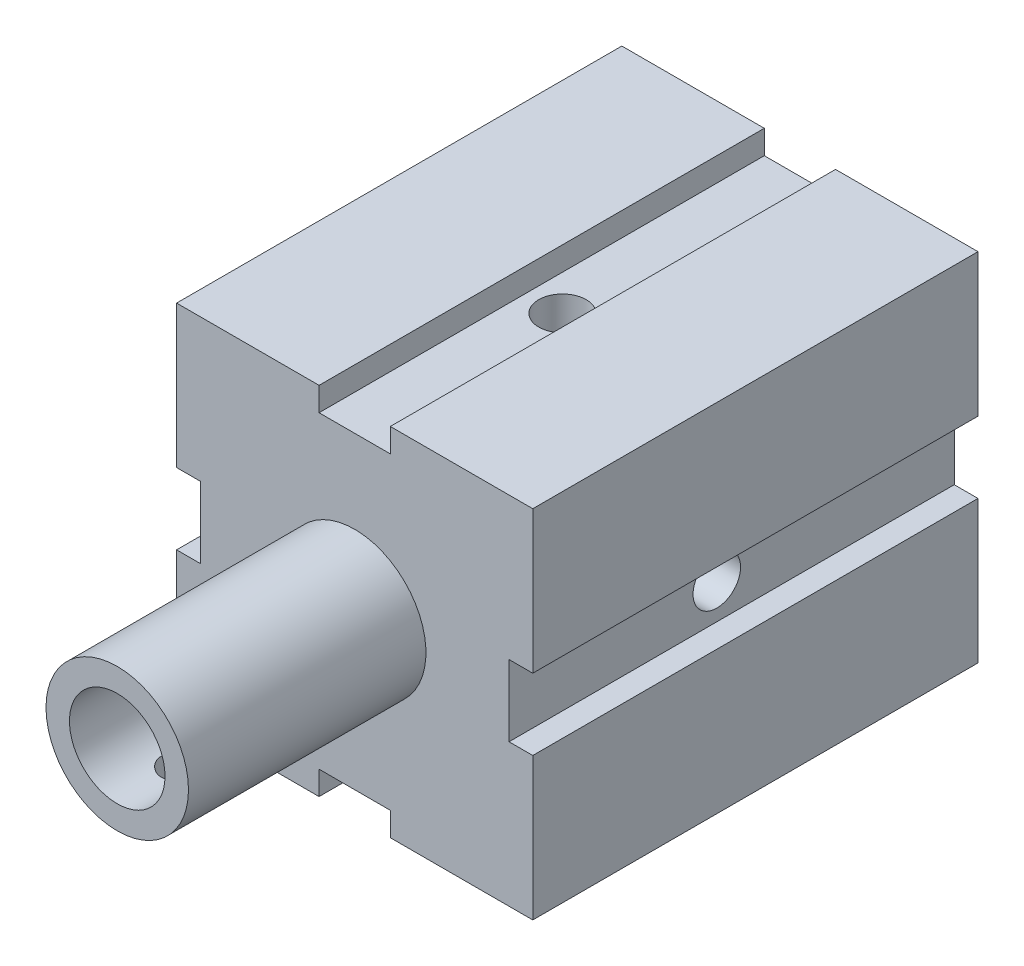
from build123d import *

# Parameters (mm, degrees)
SKETCH1_W                           = 30
SKETCH1_H                           = 30
BOSS_EXTRUDE1_DEPTH                 = 37.5
SKETCH2_R                           = 6
SKETCH2_R_2                         = 4.025
BOSS_EXTRUDE2_DEPTH                 = 20
CUT_EXTRUDE1_START                  = -10
SKETCH3_R                           = 4.025
CUT_EXTRUDE1_DEPTH                  = 10
SKETCH4_W                           = 6
SKETCH4_H                           = 75
CUT_EXTRUDE2_DEPTH                  = 2
CIRPATTERN1_COUNT                   = 4
SKETCH5_R                           = 2
CUT_EXTRUDE3_DEPTH                  = 126.128763374
SKETCH6_R                           = 2
CUT_EXTRUDE4_DEPTH                  = 339.953272019
M3X0_5_TAPPED_HOLE1_REACH           = 52.721
M3X0_5_TAPPED_HOLE1_BORE_R          = 1.25
M3X0_5_TAPPED_HOLE1_ON_FACE_2_REACH = 60.509
M3X0_5_TAPPED_HOLE1_BORE_2_R        = 1.25


with BuildPart() as part:
    # Sketch1 → Boss-Extrude1 (new body)
    with BuildSketch(Plane.XY):
        with Locations((317.864943501, 92.549790439)):
            Rectangle(SKETCH1_W, SKETCH1_H)
    extrude(amount=BOSS_EXTRUDE1_DEPTH)

    # Sketch2 → Boss-Extrude2 (add)
    with BuildSketch(Plane.XY.offset(37.5)):
        with Locations(Location((317.864943501, 92.549790439, 0), (0, 0, 180))):
            Circle(SKETCH2_R)
        with Locations((317.864943501, 92.549790439)):
            Circle(SKETCH2_R_2, mode=Mode.SUBTRACT)
    extrude(amount=BOSS_EXTRUDE2_DEPTH)

    # Sketch3 → Cut-Extrude1 (cut)
    with BuildSketch(Plane.XY.offset(37.5).offset(CUT_EXTRUDE1_START)):
        with Locations((317.864943501, 92.549790439)):
            Circle(SKETCH3_R)
    extrude(amount=CUT_EXTRUDE1_DEPTH, mode=Mode.SUBTRACT)

    # Sketch4 → Cut-Extrude2 (cut)
    with BuildSketch(Plane.XZ.offset(-77.549790439)):
        with Locations((317.864943501, 0)):
            Rectangle(SKETCH4_W, SKETCH4_H)
    cut_extrude2 = extrude(amount=-CUT_EXTRUDE2_DEPTH, mode=Mode.SUBTRACT)

    # CirPattern1: Cut-Extrude2 ×4 about axis
    cirpattern1_axis = Axis((317.864943501, 92.549790439, 0), (0, 0, 1))
    for i in range(1, CIRPATTERN1_COUNT):
        add(cut_extrude2.rotate(cirpattern1_axis, i * 360 / CIRPATTERN1_COUNT), mode=Mode.SUBTRACT)

    # Sketch5 → Cut-Extrude3 (cut, through all)
    with BuildSketch(Plane(origin=(330.864943501, 0, 0), x_dir=(0, 0, -1), z_dir=(1, 0, 0))):
        with Locations(Location((-20, 92.549790439, 0), (0, 0, 90))):
            Circle(SKETCH5_R)
    extrude(amount=-CUT_EXTRUDE3_DEPTH, mode=Mode.SUBTRACT)

    # Sketch6 → Cut-Extrude4 (cut, through all)
    with BuildSketch(Plane.XZ.offset(-79.549790439)):
        with Locations(Location((317.864943501, 20, 0), (0, 0, 270))):
            Circle(SKETCH6_R)
    extrude(amount=-CUT_EXTRUDE4_DEPTH, mode=Mode.SUBTRACT)

    # M3x0.5 Tapped Hole1 bore (on position points) → M3x0.5 Tapped Hole1 (cut, up to next)
    with BuildSketch(Plane(origin=(317.711998096, 86.551740114, 43.612753669), x_dir=(-0.99967505419, 0.025490900946, 0), z_dir=(-0.025490900946, -0.99967505419, 0)), mode=Mode.PRIVATE) as m3x0_5_tapped_hole1_sk1:
        Circle(M3X0_5_TAPPED_HOLE1_BORE_R)
    m3x0_5_tapped_hole1_tool1 = extrude(m3x0_5_tapped_hole1_sk1.sketch, amount=-M3X0_5_TAPPED_HOLE1_REACH, mode=Mode.PRIVATE) & part.part
    add(m3x0_5_tapped_hole1_tool1.solids().sort_by_distance((317.711998, 86.55174, 43.612754))[0], mode=Mode.SUBTRACT)

    # M3x0.5 Tapped Hole1 bore 2 (on position points) → M3x0.5 Tapped Hole1 on face 2 (cut, up to next)
    with BuildSketch(Plane(origin=(317.668420808, 86.553009734, 52.454806576), x_dir=(-0.99946344332, 0.032754014528, 0), z_dir=(-0.032754014528, -0.99946344332, 0)), mode=Mode.PRIVATE) as m3x0_5_tapped_hole1_on_face_2_sk1:
        Circle(M3X0_5_TAPPED_HOLE1_BORE_2_R)
    m3x0_5_tapped_hole1_on_face_2_tool1 = extrude(m3x0_5_tapped_hole1_on_face_2_sk1.sketch, amount=-M3X0_5_TAPPED_HOLE1_ON_FACE_2_REACH, mode=Mode.PRIVATE) & part.part
    add(m3x0_5_tapped_hole1_on_face_2_tool1.solids().sort_by_distance((317.668421, 86.55301, 52.454807))[0], mode=Mode.SUBTRACT)


solid = part.part
